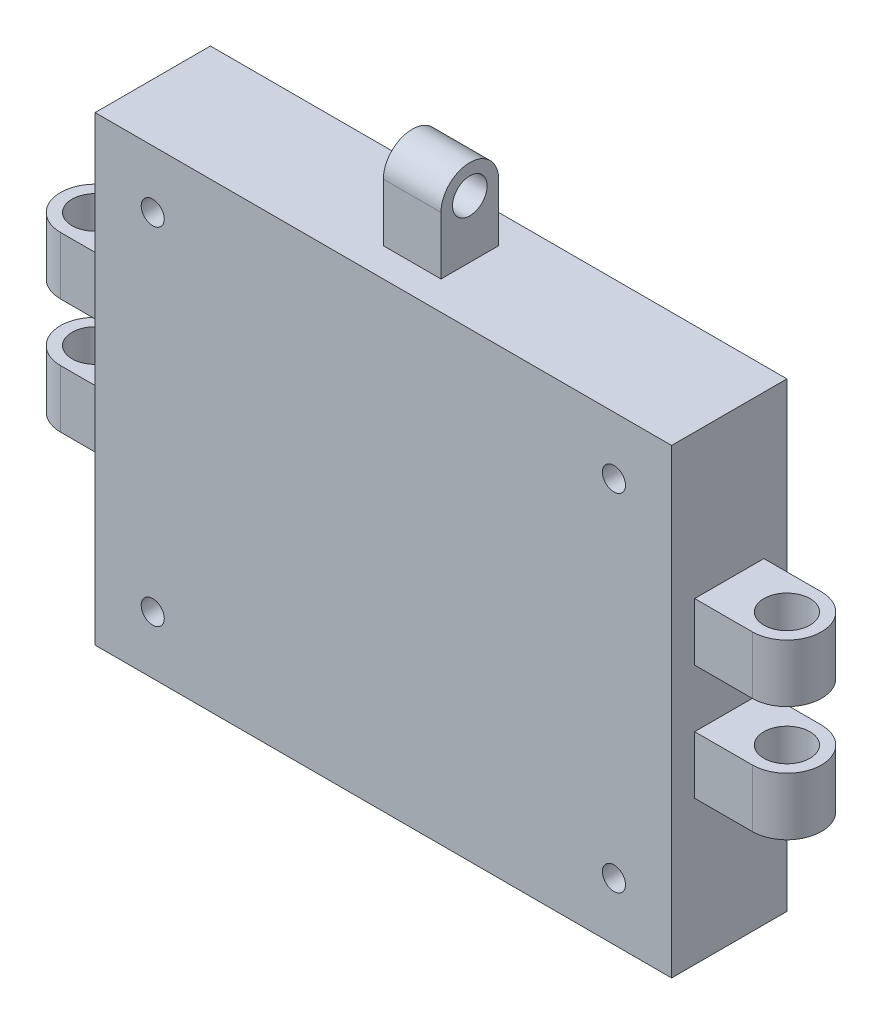
from build123d import *

# Parameters (mm, degrees)
SKETCH1_W           = 50
SKETCH1_H           = 40
BOSS_EXTRUDE1_DEPTH = 10
SKETCH5_W           = 6
SKETCH5_H           = 5
BOSS_EXTRUDE3_DEPTH = 10
SKETCH6_R           = 2
CUT_EXTRUDE1_DEPTH  = 20
SKETCH8_W           = 10
SKETCH8_H           = 40
CUT_EXTRUDE2_DEPTH  = 25
SKETCH12_W          = 5
SKETCH12_H          = 5
BOSS_EXTRUDE5_DEPTH = 10
SKETCH13_R          = 1.5
CUT_EXTRUDE4_DEPTH  = 10
SKETCH14_R          = 1
CUT_EXTRUDE5_DEPTH  = 10
CUT_EXTRUDE6_DEPTH  = 22
CUT_EXTRUDE7_DEPTH  = 30
CUT_EXTRUDE8_DEPTH  = 30


with BuildPart() as part:
    # Sketch1 → Boss-Extrude1 (new body)
    with BuildSketch(Plane(origin=(669.84184187, 0, 0), x_dir=(1, 0, 0), z_dir=(0, 0, 1))):
        with Locations((-671.310344828, 437.637931034)):
            Rectangle(SKETCH1_W, SKETCH1_H)
    boss_extrude1 = extrude(amount=BOSS_EXTRUDE1_DEPTH)

    # Sketch5 → Boss-Extrude3 (add)
    with BuildSketch(Plane(origin=(23.531497042, 0, 0), x_dir=(0, 0, -1), z_dir=(1, 0, 0))):
        with Locations((-5, 442.637931034)):
            Rectangle(SKETCH5_W, SKETCH5_H)
        with Locations((-5, 432.637931034)):
            Rectangle(SKETCH5_W, SKETCH5_H)
    boss_extrude3 = extrude(amount=BOSS_EXTRUDE3_DEPTH)

    # Sketch6 → Cut-Extrude1 (cut)
    with BuildSketch(Plane(origin=(669.84184187, 445.137931034, 0), x_dir=(1, 0, 0), z_dir=(0, 1, 0))):
        with Locations(Location((-641.310344828, -5, 0), (0, 0, 180))):
            Circle(SKETCH6_R)
    cut_extrude1 = extrude(amount=-CUT_EXTRUDE1_DEPTH, mode=Mode.SUBTRACT)

    # Sketch8 → Cut-Extrude2 (cut)
    with BuildSketch(Plane.ZY.offset(26.468502958)):
        with Locations((5, 437.637931034)):
            Rectangle(SKETCH8_W, SKETCH8_H)
    extrude(amount=-CUT_EXTRUDE2_DEPTH, mode=Mode.SUBTRACT)

    # Mirror1: Boss-Extrude1, Boss-Extrude3, Cut-Extrude1 across plane
    add(boss_extrude1.mirror(Plane(origin=(-1.468502958, 0, 0), x_dir=(0, 0, 1), z_dir=(1, 0, 0))))
    add(boss_extrude3.mirror(Plane(origin=(-1.468502958, 0, 0), x_dir=(0, 0, 1), z_dir=(1, 0, 0))))
    add(cut_extrude1.mirror(Plane(origin=(-1.468502958, 0, 0), x_dir=(0, 0, 1), z_dir=(1, 0, 0))), mode=Mode.SUBTRACT)

    # Sketch12 → Boss-Extrude5 (add)
    with BuildSketch(Plane(origin=(0, 457.637931034, 0), x_dir=(1, 0, 0), z_dir=(0, 1, 0))):
        with Locations((-1.468502958, -5)):
            Rectangle(SKETCH12_W, SKETCH12_H)
    extrude(amount=BOSS_EXTRUDE5_DEPTH)

    # Sketch13 → Cut-Extrude4 (cut)
    with BuildSketch(Plane(origin=(1.031497042, 0, 0), x_dir=(0, 0, -1), z_dir=(1, 0, 0))):
        with Locations((-5, 462.637931034)):
            Circle(SKETCH13_R)
    extrude(amount=-CUT_EXTRUDE4_DEPTH, mode=Mode.SUBTRACT)

    # Sketch14 → Cut-Extrude5 (cut)
    with BuildSketch(Plane.XY.offset(10)):
        with Locations((-21.468502958, 452.637931034)):
            Circle(SKETCH14_R)
        with Locations((-21.468502958, 422.637931034)):
            Circle(SKETCH14_R)
        with Locations((18.531497042, 452.637931034)):
            Circle(SKETCH14_R)
        with Locations((18.531497042, 422.637931034)):
            Circle(SKETCH14_R)
    extrude(amount=-CUT_EXTRUDE5_DEPTH, mode=Mode.SUBTRACT)

    # Sketch15 → Cut-Extrude6 (cut)
    with BuildSketch(Plane(origin=(0, 445.137931034, 0), x_dir=(1, 0, 0), z_dir=(0, 1, 0))):
        with BuildLine():
            Line((33.531497042, -2), (28.531497042, -2))
            ThreePointArc((28.531497042, -2), (30.652817386, -2.878679656), (31.531497042, -5))
            ThreePointArc((31.531497042, -5), (30.652817386, -7.121320344), (28.531497042, -8))
            Line((28.531497042, -8), (33.531497042, -8))
            Line((33.531497042, -8), (33.531497042, -2))
        make_face()
    extrude(amount=-CUT_EXTRUDE6_DEPTH, mode=Mode.SUBTRACT)

    # Sketch17 → Cut-Extrude7 (cut)
    with BuildSketch(Plane(origin=(0, 445.137931034, 0), x_dir=(1, 0, 0), z_dir=(0, 1, 0))):
        with BuildLine():
            Line((-36.468502958, -8), (-31.468502958, -8))
            ThreePointArc((-31.468502958, -8), (-34.468502958, -5), (-31.468502958, -2))
            Line((-31.468502958, -2), (-36.468502958, -2))
            Line((-36.468502958, -2), (-36.468502958, -8))
        make_face()
    extrude(amount=-CUT_EXTRUDE7_DEPTH, mode=Mode.SUBTRACT)

    # Sketch18 → Cut-Extrude8 (cut)
    with BuildSketch(Plane(origin=(1.031497042, 0, 0), x_dir=(0, 0, -1), z_dir=(1, 0, 0))):
        with BuildLine():
            Line((-7.5, 467.637931034), (-7.5, 462.637931034))
            ThreePointArc((-7.5, 462.637931034), (-5, 465.137931034), (-2.5, 462.637931034))
            Line((-2.5, 462.637931034), (-2.5, 467.637931034))
            Line((-2.5, 467.637931034), (-7.5, 467.637931034))
        make_face()
    extrude(amount=-CUT_EXTRUDE8_DEPTH, mode=Mode.SUBTRACT)


solid = part.part
